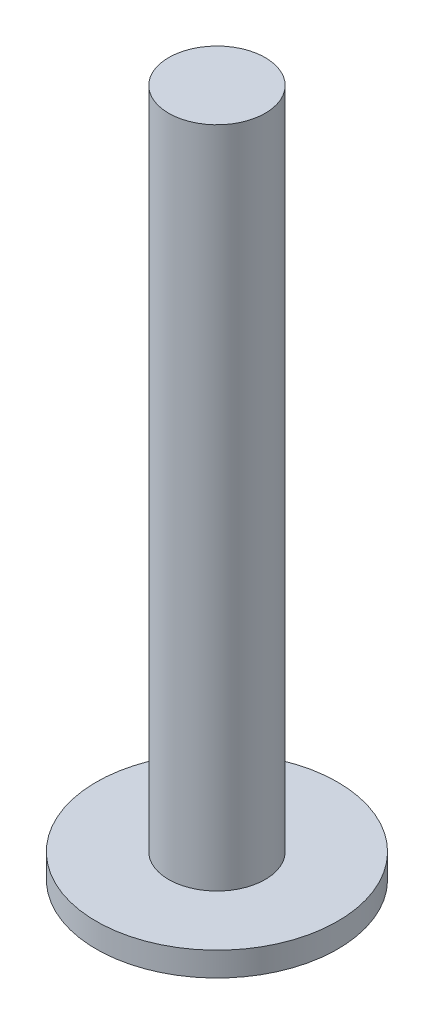
from build123d import *

# Parameters (mm, degrees)
SKETCH5_R           = 40
BOSS_EXTRUDE3_DEPTH = 550
SKETCH6_R           = 100
BOSS_EXTRUDE4_DEPTH = 20


with BuildPart() as part:
    # Sketch5 → Boss-Extrude3 (new body)
    with BuildSketch(Plane(origin=(0, 0, 0), x_dir=(1, 0, 0), z_dir=(0, 1, 0))):
        with Locations(Location((0, 0, 0), (0, 0, 270))):
            Circle(SKETCH5_R)
    extrude(amount=BOSS_EXTRUDE3_DEPTH)


with BuildPart() as body_2:
    # Sketch6 → Boss-Extrude4 (new body)
    with BuildSketch(Plane.XZ):
        with Locations(Location((0, 0, 0), (0, 0, 270))):
            Circle(SKETCH6_R)
    extrude(amount=BOSS_EXTRUDE4_DEPTH)


solid = Compound([part.part, body_2.part])
